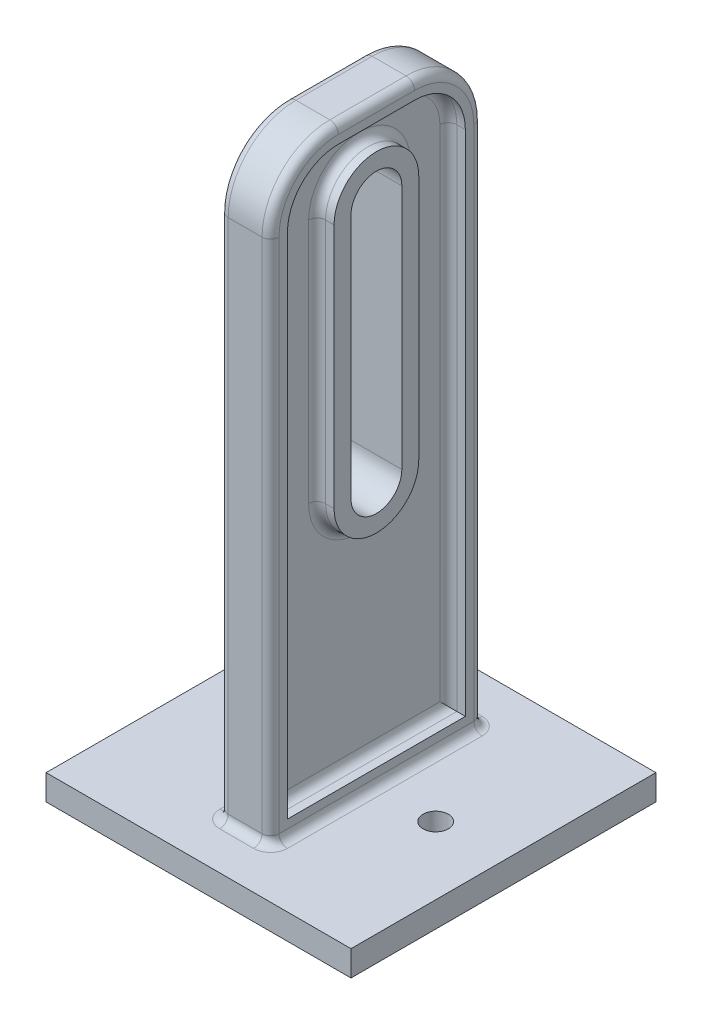
from build123d import *

# Parameters (mm, degrees)
SKETCH1_W           = 36
SKETCH1_H           = 36
BOSS_EXTRUDE1_DEPTH = 3
SKETCH2_R           = 1.5
CUT_EXTRUDE1_DEPTH  = 26.632011236
SKETCH3_W           = 6
SKETCH3_H           = 25
BOSS_EXTRUDE2_DEPTH = 70
CUT_EXTRUDE2_DEPTH  = 79.064076245
FILLET1_R           = 8
CUT_EXTRUDE3_DEPTH  = 2
FILLET2_R           = 1


with BuildPart() as part:
    # Sketch1 → Boss-Extrude1 (new body)
    with BuildSketch(Plane(origin=(0, 0, 0), x_dir=(1, 0, 0), z_dir=(0, 1, 0))):
        Rectangle(SKETCH1_W, SKETCH1_H)
    extrude(amount=BOSS_EXTRUDE1_DEPTH)

    # Sketch2 → Cut-Extrude1 (cut, through all)
    with BuildSketch(Plane(origin=(0, 3, 0), x_dir=(1, 0, 0), z_dir=(0, 1, 0))):
        with Locations(Location((-10, 0, 0), (0, 0, 270))):
            Circle(SKETCH2_R)
        with Locations(Location((10, 0, 0), (0, 0, 270))):
            Circle(SKETCH2_R)
    extrude(amount=-CUT_EXTRUDE1_DEPTH, mode=Mode.SUBTRACT)

    # Sketch3 → Boss-Extrude2 (add)
    with BuildSketch(Plane(origin=(0, 3, 0), x_dir=(1, 0, 0), z_dir=(0, 1, 0))):
        Rectangle(SKETCH3_W, SKETCH3_H)
    extrude(amount=BOSS_EXTRUDE2_DEPTH)

    # Sketch4 → Cut-Extrude2 (cut, through all)
    with BuildSketch(Plane.ZY.offset(3)):
        with BuildLine():
            Line((-3, 63), (-3, 34))
            ThreePointArc((-3, 34), (0, 31), (3, 34))
            Line((3, 34), (3, 63))
            ThreePointArc((3, 63), (0, 66), (-3, 63))
        make_face()
    extrude(amount=-CUT_EXTRUDE2_DEPTH, mode=Mode.SUBTRACT)

    # Fillet1
    fillet1_edges = [part.edges().sort_by_distance(p)[0] for p in [
        (0, 73, -12.5),
        (0, 73, 12.5),
    ]]
    fillet(fillet1_edges, radius=FILLET1_R)

    # Sketch5 → Cut-Extrude3 (cut)
    with BuildSketch(Plane.ZY.offset(3)):
        with BuildLine():
            Line((-10.5, 5), (10.5, 5))
            Line((10.5, 5), (10.5, 65))
            ThreePointArc((10.5, 65), (8.742640687, 69.242640687), (4.5, 71))
            Line((4.5, 71), (-4.5, 71))
            ThreePointArc((-4.5, 71), (-8.742640687, 69.242640687), (-10.5, 65))
            Line((-10.5, 65), (-10.5, 5))
        make_face()
        with BuildLine():
            Line((5, 34), (5, 63))
            ThreePointArc((5, 63), (0, 68), (-5, 63))
            Line((-5, 63), (-5, 34))
            ThreePointArc((-5, 34), (0, 29), (5, 34))
        make_face(mode=Mode.SUBTRACT)
    cut_extrude3 = extrude(amount=-CUT_EXTRUDE3_DEPTH, mode=Mode.SUBTRACT)

    # Mirror1: Cut-Extrude3 across plane
    add(cut_extrude3.mirror(Plane(origin=(0, 0, 0), x_dir=(0, 0, 1), z_dir=(1, 0, 0))), mode=Mode.SUBTRACT)

    # Fillet2
    fillet2_edges = [part.edges().sort_by_distance(p)[0] for p in [
        (1, 35, -10.5),
        (1, 5, 0),
        (1, 35, 10.5),
        (1, 69.242640687, 8.742640687),
        (1, 71, 0),
        (1, 69.242640687, -8.742640687),
        (1, 68, 0),
        (1, 48.5, -5),
        (1, 29, 0),
        (1, 48.5, 5),
        (3, 3, 0),
        (0, 3, -12.5),
        (-3, 3, 0),
        (0, 3, 12.5),
        (3, 73, 0),
        (-3, 73, 0),
        (-3, 34, 12.5),
        (-3, 34, -12.5),
        (-3, 70.656854249, 10.156854249),
        (-3, 70.656854249, -10.156854249),
        (3, 34, -12.5),
        (3, 34, 12.5),
        (3, 70.656854249, 10.156854249),
        (3, 70.656854249, -10.156854249),
        (-1, 35, -10.5),
        (-1, 69.242640687, -8.742640687),
        (-1, 71, 0),
        (-1, 69.242640687, 8.742640687),
        (-1, 35, 10.5),
        (-1, 5, 0),
        (-1, 48.5, 5),
        (-1, 68, 0),
        (-1, 48.5, -5),
        (-1, 29, 0),
    ]]
    fillet(fillet2_edges, radius=FILLET2_R)


solid = part.part
